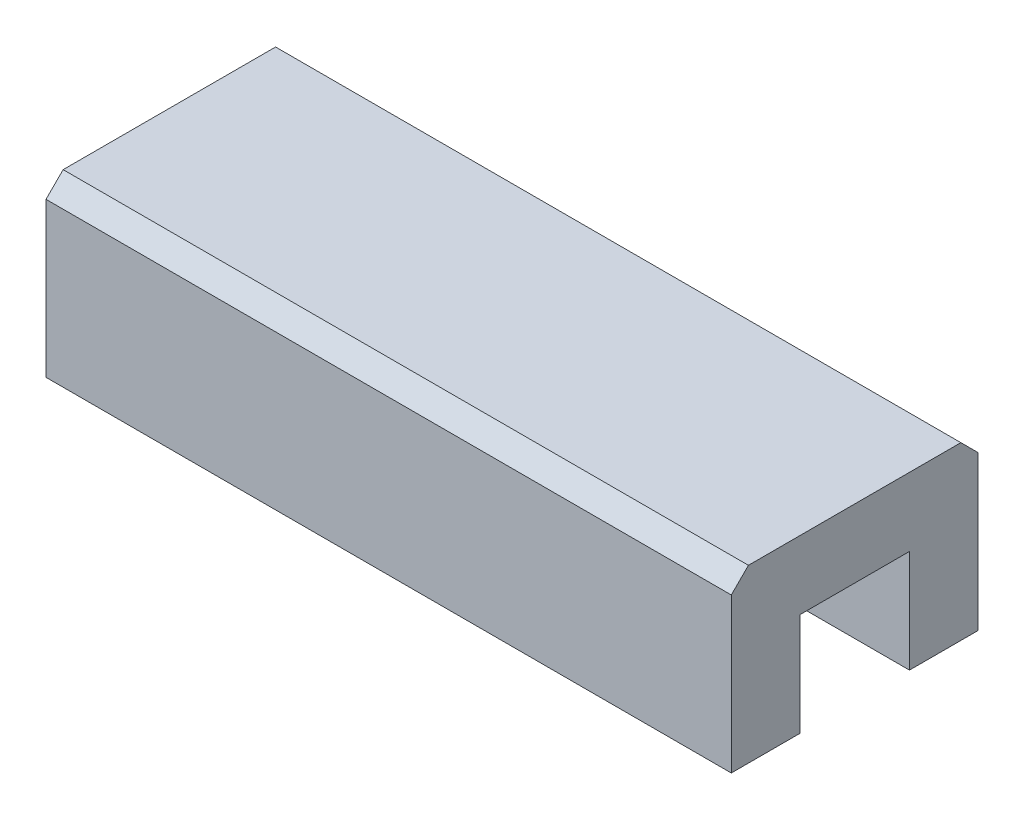
from build123d import *

# Parameters (mm, degrees)
SKETCH2_W           = 20
SKETCH2_H           = 5
BOSS_EXTRUDE1_DEPTH = 7.2
CUT_EXTRUDE1_REACH  = 23.403
SKETCH3_W           = 3.2
SKETCH3_H           = 3
CHAMFER1_SIZE       = 0.5


with BuildPart() as part:
    # Sketch2 → Boss-Extrude1 (new body)
    with BuildSketch(Plane.XY):
        Rectangle(SKETCH2_W, SKETCH2_H)
    extrude(amount=BOSS_EXTRUDE1_DEPTH)

    # Sketch3 → Cut-Extrude1 (cut, up to next)
    with BuildSketch(Plane(origin=(10, 0, 0), x_dir=(0, 0, -1), z_dir=(1, 0, 0)), mode=Mode.PRIVATE) as cut_extrude1_sk1:
        with Locations((-3.6, -1)):
            Rectangle(SKETCH3_W, SKETCH3_H)
    cut_extrude1_tool1 = extrude(cut_extrude1_sk1.sketch, amount=-CUT_EXTRUDE1_REACH, mode=Mode.PRIVATE) & part.part
    add(cut_extrude1_tool1.solids().sort_by_distance((10, -1, 3.6))[0], mode=Mode.SUBTRACT)

    # Chamfer1
    chamfer1_edges = [part.edges().sort_by_distance(p)[0] for p in [
        (0, 2.5, 0),
        (0, 2.5, 7.2),
    ]]
    chamfer(chamfer1_edges, length=CHAMFER1_SIZE)


solid = part.part
